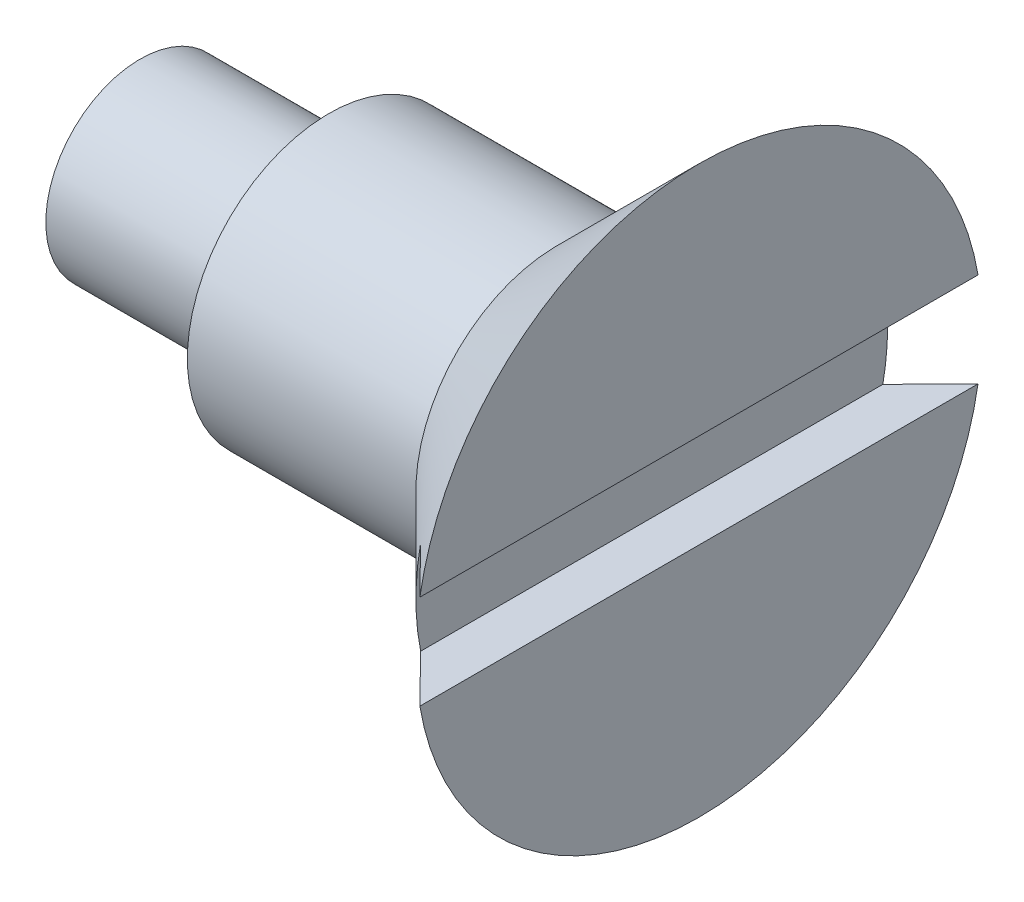
from build123d import *

# Parameters (mm, degrees)
SKETCH2_W          = 16.237911894
SKETCH2_H          = 2
CUT_EXTRUDE1_DEPTH = 1


with BuildPart() as part:
    # Sketch1 → Revolve1 (revolve)
    with BuildSketch(Plane(origin=(0, 0, 0), x_dir=(1, 0, 0), z_dir=(0, 1, 0)), mode=Mode.PRIVATE) as revolve1_sk:
        Polygon((-3, -3), (0, -6), (0, 0), (-13, 0), (-11.845299462, -2), (-7.845299462, -2), (-7.845299462, -3), align=None)
    revolve(revolve1_sk.sketch.rotate(Axis((0, 0, 0), (-1, 0, 0)), 180), axis=Axis((0, 0, 0), (-1, 0, 0)))

    # Sketch2 → Cut-Extrude1 (cut)
    with BuildSketch(Plane(origin=(0, 0, 0), x_dir=(0, 0, -1), z_dir=(1, 0, 0))):
        Rectangle(SKETCH2_W, SKETCH2_H)
    extrude(amount=-CUT_EXTRUDE1_DEPTH, mode=Mode.SUBTRACT)


solid = part.part
